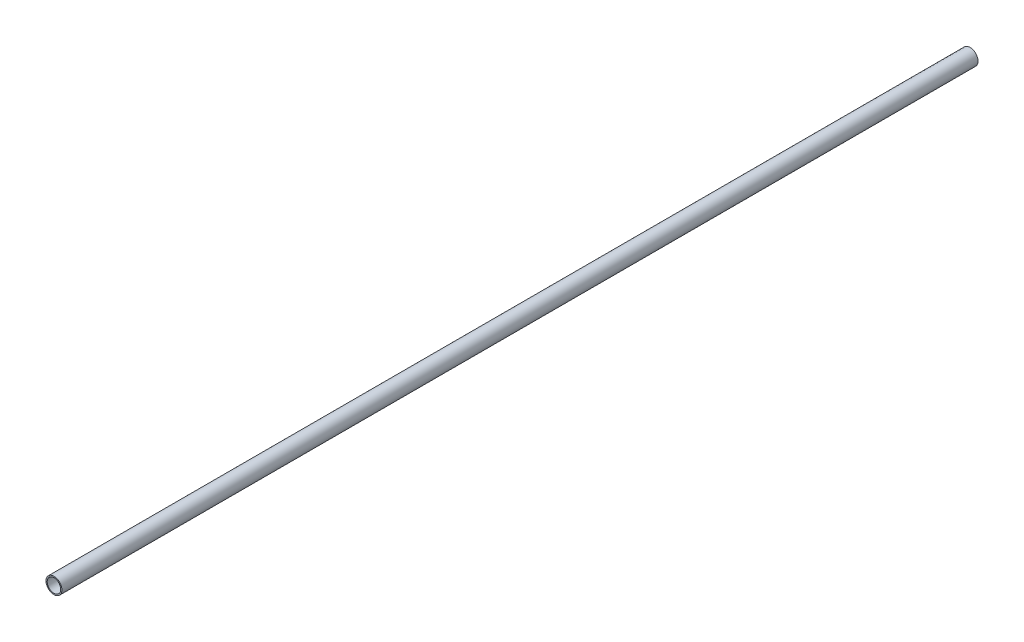
from build123d import *

# Parameters (mm, degrees)
SKETCH1_R           = 15.875
SKETCH1_R_2         = 13.462
BOSS_EXTRUDE1_DEPTH = 1828.8


with BuildPart() as part:
    # Sketch1 → Boss-Extrude1 (new body)
    with BuildSketch(Plane.XY):
        with Locations(Location((0, 0, 0), (0, 0, 180))):
            Circle(SKETCH1_R)
        with Locations(Location((0, 0, 0), (0, 0, 180))):
            Circle(SKETCH1_R_2, mode=Mode.SUBTRACT)
    extrude(amount=BOSS_EXTRUDE1_DEPTH)


solid = part.part
